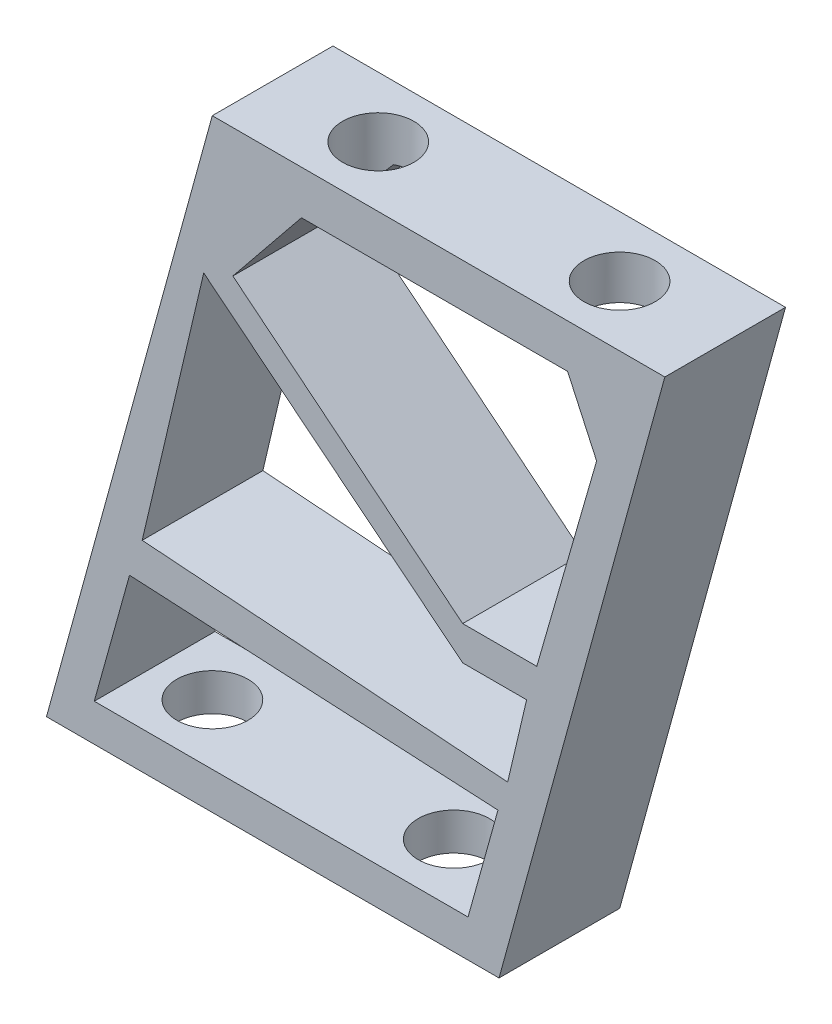
from build123d import *

# Parameters (mm, degrees)
BOSS_EXTRUDE1_DEPTH = 5.08
SKETCH3_R           = 1.5
CUT_EXTRUDE1_DEPTH  = 5.08
CUT_EXTRUDE2_DEPTH  = 7.62
SKETCH5_R           = 1.5
CUT_EXTRUDE3_DEPTH  = 2.54


with BuildPart() as part:
    # Sketch2 → Boss-Extrude1 (new body)
    with BuildSketch(Plane.XY):
        Polygon((-7.754517134, 6.868286604), (11.295482866, 6.868286604), (4.316417445, -18.531713396), (-14.733582555, -18.531713396), align=None)
    extrude(amount=BOSS_EXTRUDE1_DEPTH)

    # Sketch3 → Cut-Extrude1 (cut)
    with BuildSketch(Plane(origin=(0, 6.868286604, 0), x_dir=(1, 0, 0), z_dir=(0, 1, 0))):
        with Locations(Location((6.850482866, -2.54, 0), (0, 0, 270))):
            Circle(SKETCH3_R)
        with Locations(Location((-3.309517134, -2.54, 0), (0, 0, 270))):
            Circle(SKETCH3_R)
    extrude(amount=-CUT_EXTRUDE1_DEPTH, mode=Mode.SUBTRACT)

    # Sketch4 → Cut-Extrude2 (cut)
    with BuildSketch(Plane(origin=(0, 0, 0), x_dir=(-1, 0, 0), z_dir=(0, 0, -1))):
        Polygon((-7.203649611, 5.025464096), (-8.423391825, 2.370731042), (-5.904798927, -6.376274022), (-2.786072566, -6.376274022), (6.889117517, 1.455631702), (3.999397468, 5.025464096), align=None)
        Polygon((8.115115025, 0.956019878), (10.704300182, -10.086093291), (-4.679537518, -11.209249583), (-5.476805356, -7.809136742), (-2.786072566, -7.809136742), align=None)
        Polygon((-4.271117048, -12.434510993), (-3.011820599, -16.961171201), (12.721835887, -16.961171201), (11.237306322, -11.624889252), align=None)
    extrude(amount=-CUT_EXTRUDE2_DEPTH, mode=Mode.SUBTRACT)

    # Sketch5 → Cut-Extrude3 (cut)
    with BuildSketch(Plane.XZ.offset(18.531713396)):
        with Locations(Location((-0.128582555, 2.54, 0), (0, 0, 270))):
            Circle(SKETCH5_R)
        with Locations(Location((-10.288582555, 2.54, 0), (0, 0, 270))):
            Circle(SKETCH5_R)
    extrude(amount=-CUT_EXTRUDE3_DEPTH, mode=Mode.SUBTRACT)


solid = part.part
